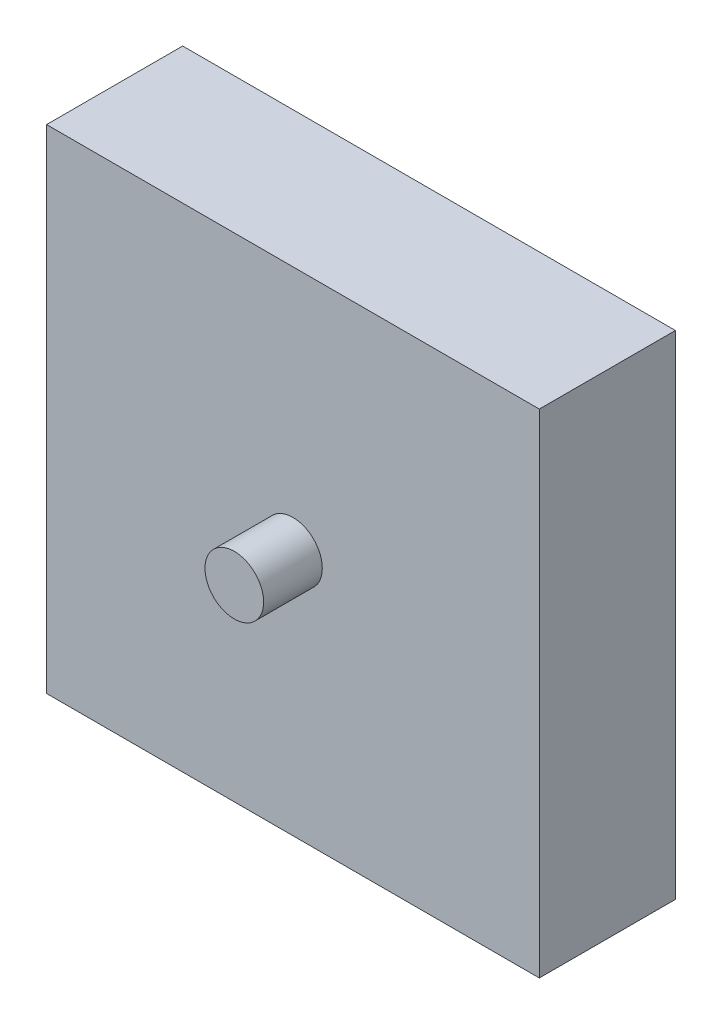
from build123d import *

# Parameters (mm, degrees)
SKETCH1_W                = 42
SKETCH1_H                = 42
BOSS_EXTRUDE1_DEPTH      = 11.6
BOSS_EXTRUDE2_DEPTH      = 5
BOSS_EXTRUDE2_DEPTH_BACK = 18.6
SKETCH2_R                = 2.5


with BuildPart() as part:
    # Sketch1 → Boss-Extrude1 (new body)
    with BuildSketch(Plane.XY):
        Rectangle(SKETCH1_W, SKETCH1_H)
    extrude(amount=BOSS_EXTRUDE1_DEPTH)

    # Sketch2 → Boss-Extrude2 (add, two sides: drawn at the far end of the back side and taken through both)
    with BuildSketch(Plane.XY.offset(11.6).offset(-BOSS_EXTRUDE2_DEPTH_BACK)):
        with Locations(Location((0, 0, 0), (0, 0, 180))):
            Circle(SKETCH2_R)
    extrude(amount=BOSS_EXTRUDE2_DEPTH + BOSS_EXTRUDE2_DEPTH_BACK)


solid = part.part
